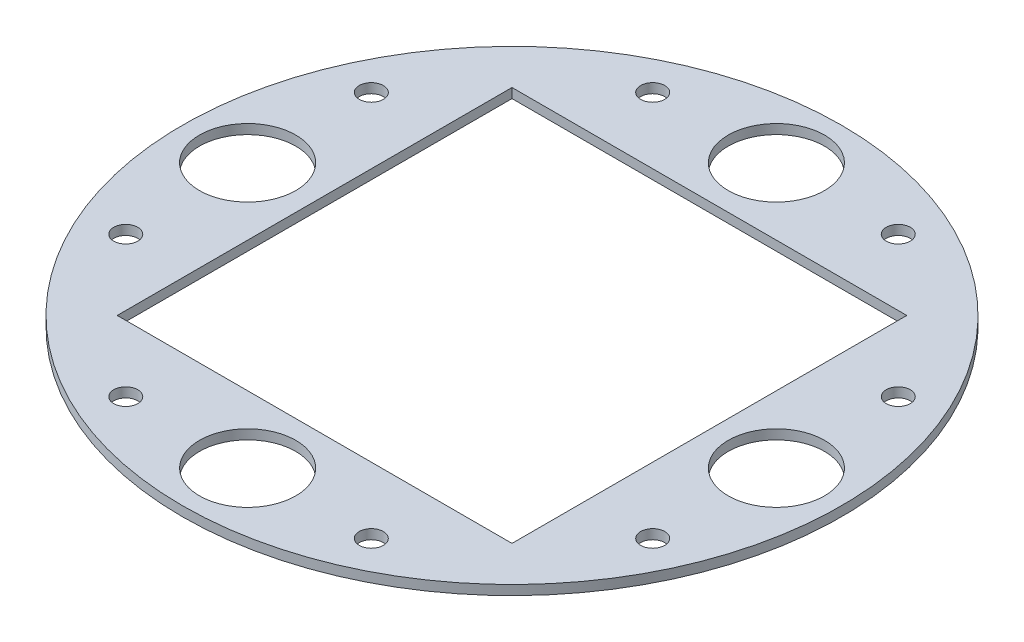
from build123d import *

# Parameters (mm, degrees)
SKETCH1_R           = 86.9315
BOSS_EXTRUDE1_DEPTH = 2.54
SKETCH3_W           = 104.14
SKETCH3_H           = 104.14
CUT_EXTRUDE2_DEPTH  = 2.54
SKETCH4_R           = 3.175
CUT_EXTRUDE3_DEPTH  = 2.54
SKETCH5_R           = 12.7
CUT_EXTRUDE4_DEPTH  = 123.965942376
CIRPATTERN1_COUNT   = 4


with BuildPart() as part:
    # Sketch1 → Boss-Extrude1 (new body)
    with BuildSketch(Plane(origin=(0, 0, 0), x_dir=(1, 0, 0), z_dir=(0, 1, 0))):
        with Locations(Location((0, 0, 0), (0, 0, 270))):
            Circle(SKETCH1_R)
    extrude(amount=BOSS_EXTRUDE1_DEPTH)

    # Sketch3 → Cut-Extrude2 (cut)
    with BuildSketch(Plane(origin=(0, 2.54, 0), x_dir=(1, 0, 0), z_dir=(0, 1, 0))):
        Rectangle(SKETCH3_W, SKETCH3_H)
    extrude(amount=-CUT_EXTRUDE2_DEPTH, mode=Mode.SUBTRACT)

    # Sketch4 → Cut-Extrude3 (cut)
    with BuildSketch(Plane(origin=(0, 2.54, 0), x_dir=(1, 0, 0), z_dir=(0, 1, 0))):
        with Locations(Location((-32.385, -69.50075, 0), (0, 0, 270))):
            Circle(SKETCH4_R)
        with Locations(Location((-69.50075, -32.385, 0), (0, 0, 270))):
            Circle(SKETCH4_R)
        with Locations(Location((69.50075, 32.385, 0), (0, 0, 270))):
            Circle(SKETCH4_R)
        with Locations(Location((-69.50075, 32.385, 0), (0, 0, 90))):
            Circle(SKETCH4_R)
        with Locations(Location((-32.385, 69.50075, 0), (0, 0, 270))):
            Circle(SKETCH4_R)
        with Locations(Location((32.385, 69.50075, 0), (0, 0, 90))):
            Circle(SKETCH4_R)
        with Locations(Location((69.50075, -32.385, 0), (0, 0, 90))):
            Circle(SKETCH4_R)
        with Locations(Location((32.385, -69.50075, 0), (0, 0, 270))):
            Circle(SKETCH4_R)
    extrude(amount=-CUT_EXTRUDE3_DEPTH, mode=Mode.SUBTRACT)

    # Sketch5 → Cut-Extrude4 (cut, through all)
    with BuildSketch(Plane(origin=(0, 2.54, 0), x_dir=(1, 0, 0), z_dir=(0, 1, 0))):
        with Locations(Location((-69.738430692, 0, 0), (0, 0, 270))):
            Circle(SKETCH5_R)
    cut_extrude4 = extrude(amount=-CUT_EXTRUDE4_DEPTH, mode=Mode.SUBTRACT)

    # CirPattern1: Cut-Extrude4 ×4 about axis
    cirpattern1_axis = Axis((0, 0, 0), (0, 1, 0))
    for i in range(1, CIRPATTERN1_COUNT):
        add(cut_extrude4.rotate(cirpattern1_axis, i * 360 / CIRPATTERN1_COUNT), mode=Mode.SUBTRACT)


solid = part.part
